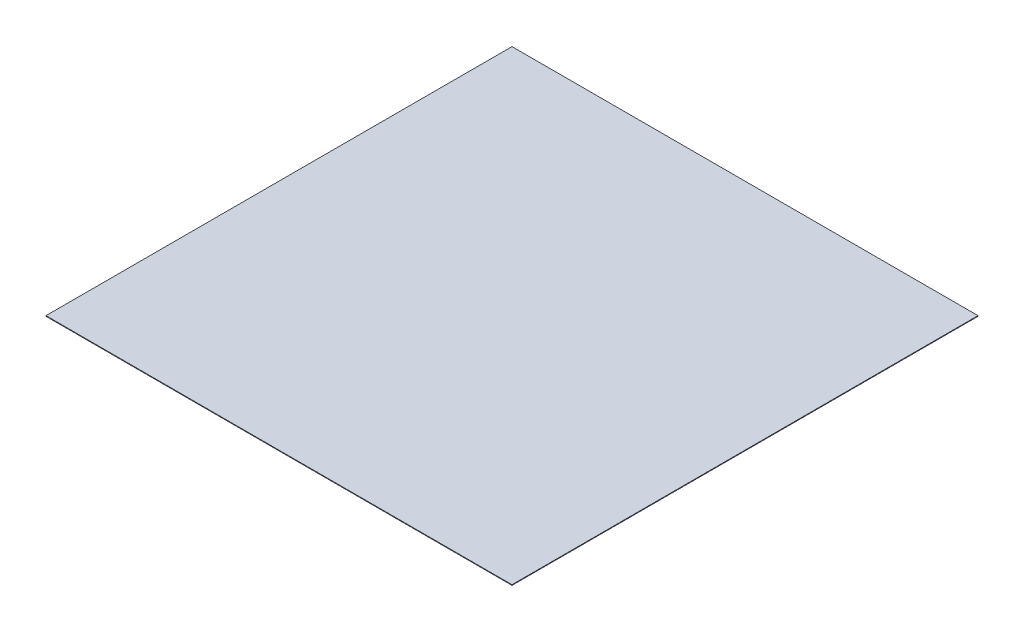
from build123d import *

# Parameters (mm, degrees)
SKETCH1_W           = 76.2
SKETCH1_H           = 76.2
BOSS_EXTRUDE1_DEPTH = 0.1016


with BuildPart() as part:
    # Sketch1 → Boss-Extrude1 (new body)
    with BuildSketch(Plane(origin=(0, 0, 0), x_dir=(1, 0, 0), z_dir=(0, 1, 0))):
        with Locations((38.1, 38.1)):
            Rectangle(SKETCH1_W, SKETCH1_H)
    extrude(amount=BOSS_EXTRUDE1_DEPTH)


solid = part.part
